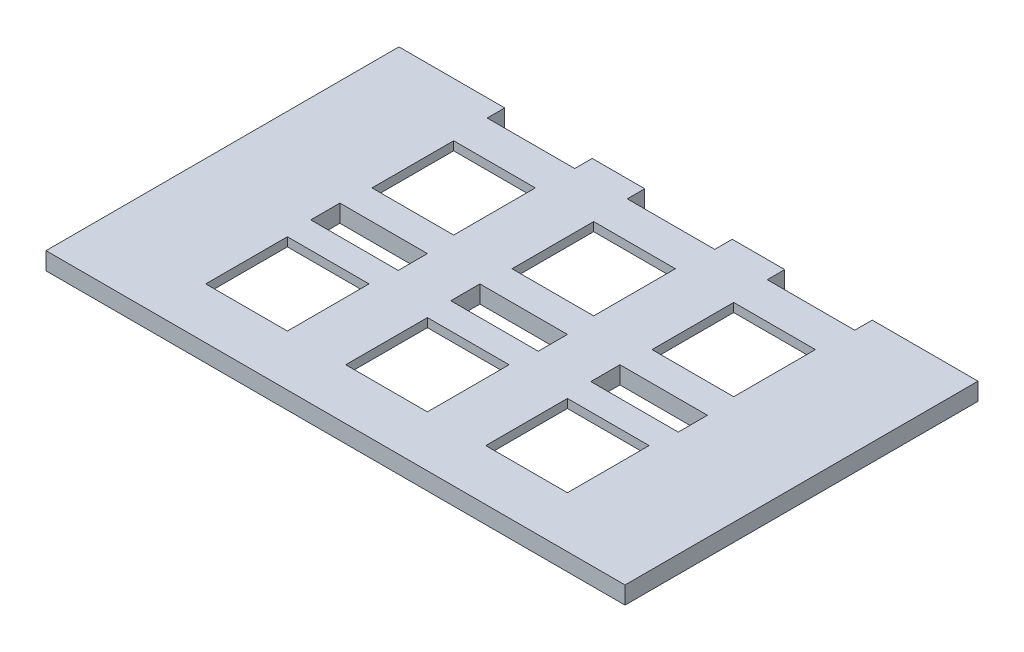
from build123d import *

# Parameters (mm, degrees)
SKETCH1_W               = 88.5
SKETCH1_H               = 60.5
BOSS_EXTRUDE1_DEPTH     = 3
SKETCH2_W               = 55.9
SKETCH2_H               = 3
BOSS_EXTRUDE2_DEPTH     = 5.375
SKETCH3_W               = 14
SKETCH3_H               = 14
CUT_EXTRUDE4_DEPTH      = 112.72182251
SKETCH7_W               = 20
SKETCH7_H               = 20
CUT_EXTRUDE5_DEPTH      = 1.5
SKETCH9_W               = 15
SKETCH9_H               = 3
CUT_EXTRUDE6_DEPTH      = 3
SKETCH10_W              = 14
SKETCH10_H              = 14
CUT_EXTRUDE7_DEPTH      = 10
SKETCH11_W              = 20
SKETCH11_H              = 20
CUT_EXTRUDE8_DEPTH      = 1.5
SKETCH12_W              = 15
SKETCH12_H              = 3
CUT_EXTRUDE9_DEPTH      = 40
MIRROR8_COPY_1_SKETCH_W = 14
MIRROR8_COPY_1_SKETCH_H = 14
MIRROR8_COPY_1_DEPTH    = 112.72182251
MIRROR8_COPY_2_SKETCH_W = 20
MIRROR8_COPY_2_SKETCH_H = 20
MIRROR8_COPY_2_DEPTH    = 1.5
SKETCH13_W              = 5.375
SKETCH13_H              = 2.3
BOSS_EXTRUDE3_DEPTH     = 3
SKETCH15_W              = 15
SKETCH15_H              = 5
CUT_EXTRUDE11_DEPTH     = 112.72182251


with BuildPart() as part:
    # Sketch1 → Boss-Extrude1 (new body)
    with BuildSketch(Plane(origin=(0, 0, 0), x_dir=(1, 0, 0), z_dir=(0, 1, 0))):
        with Locations((44.25, 30.25)):
            Rectangle(SKETCH1_W, SKETCH1_H)
    extrude(amount=BOSS_EXTRUDE1_DEPTH)

    # Sketch2 → Boss-Extrude2 (add)
    with BuildSketch(Plane(origin=(88.5, 0, 0), x_dir=(0, 0, -1), z_dir=(1, 0, 0))):
        with Locations((30.25, 1.5)):
            Rectangle(SKETCH2_W, SKETCH2_H)
    boss_extrude2 = extrude(amount=BOSS_EXTRUDE2_DEPTH)

    # Mirror2: Boss-Extrude2 across plane
    add(boss_extrude2.mirror(Plane(origin=(44.25, 0, 0), x_dir=(0, 0, 1), z_dir=(1, 0, 0))))

    # Sketch3 → Cut-Extrude4 (cut, through all)
    with BuildSketch(Plane.XZ):
        with Locations((20.25, -44.25)):
            Rectangle(SKETCH3_W, SKETCH3_H)
    cut_extrude4 = extrude(amount=-CUT_EXTRUDE4_DEPTH, mode=Mode.SUBTRACT)

    # Sketch7 → Cut-Extrude5 (cut)
    with BuildSketch(Plane.XZ):
        with Locations((20.25, -44.25)):
            Rectangle(SKETCH7_W, SKETCH7_H)
    cut_extrude5 = extrude(amount=-CUT_EXTRUDE5_DEPTH, mode=Mode.SUBTRACT)

    # Mirror4: Cut-Extrude4, Cut-Extrude5 across plane
    add(cut_extrude4.mirror(Plane(origin=(44.25, 0, 0), x_dir=(0, 0, 1), z_dir=(1, 0, 0))), mode=Mode.SUBTRACT)
    add(cut_extrude5.mirror(Plane(origin=(44.25, 0, 0), x_dir=(0, 0, 1), z_dir=(1, 0, 0))), mode=Mode.SUBTRACT)

    # Sketch9 → Cut-Extrude6 (cut)
    with BuildSketch(Plane(origin=(0, 0, -60.5), x_dir=(-1, 0, 0), z_dir=(0, 0, -1))):
        with Locations((-20.25, 1.5)):
            Rectangle(SKETCH9_W, SKETCH9_H)
    cut_extrude6 = extrude(amount=-CUT_EXTRUDE6_DEPTH, mode=Mode.SUBTRACT)

    # Mirror6: Cut-Extrude6 across plane
    add(cut_extrude6.mirror(Plane(origin=(44.25, 0, 0), x_dir=(0, 0, 1), z_dir=(1, 0, 0))), mode=Mode.SUBTRACT)

    # Sketch10 → Cut-Extrude7 (cut)
    with BuildSketch(Plane(origin=(0, 3, 0), x_dir=(1, 0, 0), z_dir=(0, 1, 0))):
        with Locations((44.25, 44.25)):
            Rectangle(SKETCH10_W, SKETCH10_H)
    cut_extrude7 = extrude(amount=-CUT_EXTRUDE7_DEPTH, mode=Mode.SUBTRACT)

    # Sketch11 → Cut-Extrude8 (cut)
    with BuildSketch(Plane.XZ):
        with Locations((44.25, -44.25)):
            Rectangle(SKETCH11_W, SKETCH11_H)
    cut_extrude8 = extrude(amount=-CUT_EXTRUDE8_DEPTH, mode=Mode.SUBTRACT)

    # Sketch12 → Cut-Extrude9 (cut)
    with BuildSketch(Plane.XZ):
        with Locations((44.25, -59)):
            Rectangle(SKETCH12_W, SKETCH12_H)
    extrude(amount=-CUT_EXTRUDE9_DEPTH, mode=Mode.SUBTRACT)

    # Mirror8: Cut-Extrude4, Cut-Extrude5, Cut-Extrude7, Cut-Extrude8 across plane
    add(cut_extrude4.mirror(Plane.XY.offset(-30)), mode=Mode.SUBTRACT)
    add(cut_extrude5.mirror(Plane.XY.offset(-30)), mode=Mode.SUBTRACT)
    add(cut_extrude7.mirror(Plane.XY.offset(-30)), mode=Mode.SUBTRACT)
    add(cut_extrude8.mirror(Plane.XY.offset(-30)), mode=Mode.SUBTRACT)

    # Mirror8 copy 1 sketch → Mirror8 copy 1 (cut, through all)
    with BuildSketch(Plane(origin=(88.5, 0, -60), x_dir=(-1, 0, 0), z_dir=(0, -1, 0))):
        with Locations((20.25, -44.25)):
            Rectangle(MIRROR8_COPY_1_SKETCH_W, MIRROR8_COPY_1_SKETCH_H)
    extrude(amount=-MIRROR8_COPY_1_DEPTH, mode=Mode.SUBTRACT)

    # Mirror8 copy 2 sketch → Mirror8 copy 2 (cut)
    with BuildSketch(Plane(origin=(88.5, 0, -60), x_dir=(-1, 0, 0), z_dir=(0, -1, 0))):
        with Locations((20.25, -44.25)):
            Rectangle(MIRROR8_COPY_2_SKETCH_W, MIRROR8_COPY_2_SKETCH_H)
    extrude(amount=-MIRROR8_COPY_2_DEPTH, mode=Mode.SUBTRACT)

    # Sketch13 → Boss-Extrude3 (add)
    with BuildSketch(Plane(origin=(0, 3, 0), x_dir=(1, 0, 0), z_dir=(0, 1, 0))):
        with Locations((-2.6875, 59.35)):
            Rectangle(SKETCH13_W, SKETCH13_H)
        with Locations((-2.6875, 1.15)):
            Rectangle(SKETCH13_W, SKETCH13_H)
        with Locations((91.1875, 1.15)):
            Rectangle(SKETCH13_W, SKETCH13_H)
        with Locations((91.1875, 59.35)):
            Rectangle(SKETCH13_W, SKETCH13_H)
    extrude(amount=-BOSS_EXTRUDE3_DEPTH)

    # Sketch15 → Cut-Extrude11 (cut, through all)
    with BuildSketch(Plane.XZ):
        with Locations((20.25, -29.75)):
            Rectangle(SKETCH15_W, SKETCH15_H)
        with Locations((44.25, -29.75)):
            Rectangle(SKETCH15_W, SKETCH15_H)
        with Locations((68.25, -29.75)):
            Rectangle(SKETCH15_W, SKETCH15_H)
    extrude(amount=-CUT_EXTRUDE11_DEPTH, mode=Mode.SUBTRACT)


solid = part.part
